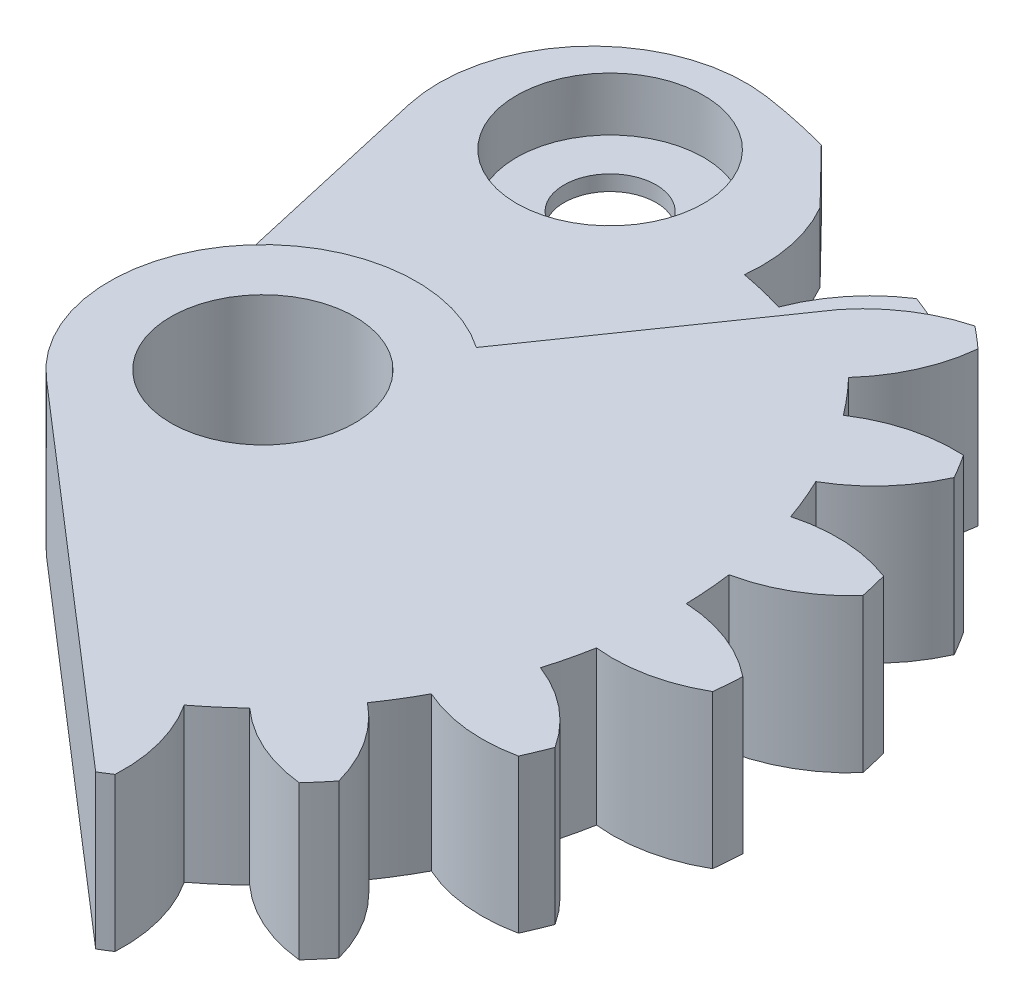
from build123d import *

# Parameters (mm, degrees)
SKETCH_1_R          = 27
EXTRUDE_2_DEPTH     = 10
EXTRUDE_START       = -10
EXTRUDE_3_DEPTH     = 10
CUT_EXTRUDE_2_DEPTH = 48.669538272
SKETCH_6_R          = 6
CUT_EXTRUDE_3_DEPTH = 10
EXTRUDE_5_DEPTH     = 10
SKETCH_10_R         = 6.1
CUT_EXTRUDE_5_DEPTH = 10
CUT_EXTRUDE_START   = -10
CUT_EXTRUDE_6_DEPTH = 10
FILLET_1_R          = 10
CUT_EXTRUDE_START_2 = -5.5
SKETCH_14_R         = 6.1
CUT_EXTRUDE_7_DEPTH = 5.5
EXTRUDE_START_2     = -1
SKETCH_15_R         = 6.1
SKETCH_15_R_2       = 3
EXTRUDE_6_DEPTH     = 1


with BuildPart() as part:
    # 草图1 → 凸台-拉伸2 (new body)
    with BuildSketch(Plane(origin=(0, 0, 0), x_dir=(1, 0, 0), z_dir=(0, 1, 0))):
        with Locations(Location((0, 0, 0), (0, 0, 270))):
            Circle(SKETCH_1_R)
    extrude(amount=EXTRUDE_2_DEPTH)

    # 草图3 → 凸台-拉伸3 (add)
    with BuildSketch(Plane(origin=(0, 10, 0), x_dir=(1, 0, 0), z_dir=(0, 1, 0)).offset(EXTRUDE_START)):
        with BuildLine():
            ThreePointArc((-3.623654542, 26.755730746), (-4.775668185, 29.776890365), (-6.810627033, 32.289554959))
            ThreePointArc((-6.810627033, 32.289554959), (-7.703697007, 32.088207373), (-8.590838072, 31.862164101))
            ThreePointArc((-8.590838072, 31.862164101), (-9.263273827, 28.699511571), (-8.918147734, 25.484635391))
            ThreePointArc((-8.918147734, 25.484635391), (-6.303024824, 26.253987851), (-3.623654542, 26.755730746))
        make_face()
        with BuildLine():
            ThreePointArc((-11.714275763, 24.326441239), (-13.743495509, 26.843742988), (-16.455312443, 28.604592156))
            ThreePointArc((-16.455312443, 28.604592156), (-17.242452636, 28.137125424), (-18.016322714, 27.648003832))
            ThreePointArc((-18.016322714, 27.648003832), (-17.678533741, 24.432348458), (-16.356847947, 21.481469346))
            ThreePointArc((-16.356847947, 21.481469346), (-14.107461247, 23.021284438), (-11.714275763, 24.326441239))
        make_face()
        with BuildLine():
            ThreePointArc((-18.658222053, 19.515910171), (-21.366013737, 21.282943016), (-24.48923722, 22.119612574))
            ThreePointArc((-24.48923722, 22.119612574), (-25.093396865, 21.431785595), (-25.678244161, 20.727464312))
            ThreePointArc((-25.678244161, 20.727464312), (-24.363295599, 17.773576848), (-22.194425918, 15.375547411))
            ThreePointArc((-22.194425918, 15.375547411), (-20.530961071, 17.535097305), (-18.658222053, 19.515910171))
        make_face()
        with BuildLine():
            ThreePointArc((-23.77577157, 12.79502584), (-26.897077674, 13.638820294), (-30.125984831, 13.469411196))
            ThreePointArc((-30.125984831, 13.469411196), (-30.488024573, 12.628553268), (-30.826600159, 11.777976169))
            ThreePointArc((-30.826600159, 11.777976169), (-28.663208335, 9.3750037), (-25.859458842, 7.764559768))
            ThreePointArc((-25.859458842, 7.764559768), (-24.944747378, 10.332452674), (-23.77577157, 12.79502584))
        make_face()
        with BuildLine():
            ThreePointArc((-26.56598291, 4.821675232), (-29.795268245, 4.659634815), (-32.813791147, 3.500730003))
            ThreePointArc((-32.813791147, 3.500730003), (-32.898272013, 2.589150159), (-32.957433752, 1.675577656))
            ThreePointArc((-32.957433752, 1.675577656), (-30.15736653, 0.05873987), (-26.993187762, -0.606477084))
            ThreePointArc((-26.993187762, -0.606477084), (-26.916768011, 2.118395585), (-26.56598291, 4.821675232))
        make_face()
        with BuildLine():
            ThreePointArc((-32.289554959, -6.810627033), (-32.088207373, -7.703697007), (-31.862164101, -8.590838072))
            ThreePointArc((-31.862164101, -8.590838072), (-28.699511571, -9.263273827), (-25.484635391, -8.918147734))
            ThreePointArc((-25.484635391, -8.918147734), (-26.253987851, -6.303024824), (-26.755730746, -3.623654542))
            ThreePointArc((-26.755730746, -3.623654542), (-29.776890365, -4.775668185), (-32.289554959, -6.810627033))
        make_face()
        with BuildLine():
            ThreePointArc((-28.604592156, -16.455312443), (-28.137125424, -17.242452636), (-27.648003832, -18.016322714))
            ThreePointArc((-27.648003832, -18.016322714), (-24.432348458, -17.678533741), (-21.481469346, -16.356847947))
            ThreePointArc((-21.481469346, -16.356847947), (-23.021284438, -14.107461247), (-24.326441239, -11.714275763))
            ThreePointArc((-24.326441239, -11.714275763), (-26.843742988, -13.743495509), (-28.604592156, -16.455312443))
        make_face()
        with BuildLine():
            ThreePointArc((-22.119612574, -24.48923722), (-21.431785595, -25.093396865), (-20.727464312, -25.678244161))
            ThreePointArc((-20.727464312, -25.678244161), (-17.773576848, -24.363295599), (-15.375547411, -22.194425918))
            ThreePointArc((-15.375547411, -22.194425918), (-17.535097305, -20.530961071), (-19.515910171, -18.658222053))
            ThreePointArc((-19.515910171, -18.658222053), (-21.282943016, -21.366013737), (-22.119612574, -24.48923722))
        make_face()
        with BuildLine():
            ThreePointArc((-13.469411196, -30.125984831), (-12.628553268, -30.488024573), (-11.777976169, -30.826600159))
            ThreePointArc((-11.777976169, -30.826600159), (-9.3750037, -28.663208335), (-7.764559768, -25.859458842))
            ThreePointArc((-7.764559768, -25.859458842), (-10.332452674, -24.944747378), (-12.79502584, -23.77577157))
            ThreePointArc((-12.79502584, -23.77577157), (-13.638820294, -26.897077674), (-13.469411196, -30.125984831))
        make_face()
        with BuildLine():
            ThreePointArc((-3.500730003, -32.813791147), (-2.589150159, -32.898272013), (-1.675577656, -32.957433752))
            ThreePointArc((-1.675577656, -32.957433752), (-0.05873987, -30.15736653), (0.606477084, -26.993187762))
            ThreePointArc((0.606477084, -26.993187762), (-2.118395585, -26.916768011), (-4.821675232, -26.56598291))
            ThreePointArc((-4.821675232, -26.56598291), (-4.659634815, -29.795268245), (-3.500730003, -32.813791147))
        make_face()
        with BuildLine():
            ThreePointArc((6.810627033, -32.289554959), (7.703697007, -32.088207373), (8.590838072, -31.862164101))
            ThreePointArc((8.590838072, -31.862164101), (9.263273827, -28.699511571), (8.918147734, -25.484635391))
            ThreePointArc((8.918147734, -25.484635391), (6.303024824, -26.253987851), (3.623654542, -26.755730746))
            ThreePointArc((3.623654542, -26.755730746), (4.775668185, -29.776890365), (6.810627033, -32.289554959))
        make_face()
        with BuildLine():
            ThreePointArc((16.455312443, -28.604592156), (17.242452636, -28.137125424), (18.016322714, -27.648003832))
            ThreePointArc((18.016322714, -27.648003832), (17.678533741, -24.432348458), (16.356847947, -21.481469346))
            ThreePointArc((16.356847947, -21.481469346), (14.107461247, -23.021284438), (11.714275763, -24.326441239))
            ThreePointArc((11.714275763, -24.326441239), (13.743495509, -26.843742988), (16.455312443, -28.604592156))
        make_face()
        with BuildLine():
            ThreePointArc((24.48923722, -22.119612574), (25.093396865, -21.431785595), (25.678244161, -20.727464312))
            ThreePointArc((25.678244161, -20.727464312), (24.363295599, -17.773576848), (22.194425918, -15.375547411))
            ThreePointArc((22.194425918, -15.375547411), (20.530961071, -17.535097305), (18.658222053, -19.515910171))
            ThreePointArc((18.658222053, -19.515910171), (21.366013737, -21.282943016), (24.48923722, -22.119612574))
        make_face()
        with BuildLine():
            ThreePointArc((30.125984831, -13.469411196), (30.488024573, -12.628553268), (30.826600159, -11.777976169))
            ThreePointArc((30.826600159, -11.777976169), (28.663208335, -9.3750037), (25.859458842, -7.764559768))
            ThreePointArc((25.859458842, -7.764559768), (24.944747378, -10.332452674), (23.77577157, -12.79502584))
            ThreePointArc((23.77577157, -12.79502584), (26.897077674, -13.638820294), (30.125984831, -13.469411196))
        make_face()
        with BuildLine():
            ThreePointArc((32.813791147, -3.500730003), (32.898272013, -2.589150159), (32.957433752, -1.675577656))
            ThreePointArc((32.957433752, -1.675577656), (30.15736653, -0.05873987), (26.993187762, 0.606477084))
            ThreePointArc((26.993187762, 0.606477084), (26.998296887, 0.303257671), (27, 0))
            ThreePointArc((27, 0), (26.891276825, -2.420584789), (26.56598291, -4.821675232))
            ThreePointArc((26.56598291, -4.821675232), (29.795268245, -4.659634815), (32.813791147, -3.500730003))
        make_face()
        with BuildLine():
            ThreePointArc((26.755730746, 3.623654542), (29.776890365, 4.775668185), (32.289554959, 6.810627033))
            ThreePointArc((32.289554959, 6.810627033), (32.088207373, 7.703697007), (31.862164101, 8.590838072))
            ThreePointArc((31.862164101, 8.590838072), (28.699511571, 9.263273827), (25.484635391, 8.918147734))
            ThreePointArc((25.484635391, 8.918147734), (26.253987851, 6.303024824), (26.755730746, 3.623654542))
        make_face()
        with BuildLine():
            ThreePointArc((24.326441239, 11.714275763), (26.843742988, 13.743495509), (28.604592156, 16.455312443))
            ThreePointArc((28.604592156, 16.455312443), (28.137125424, 17.242452636), (27.648003832, 18.016322714))
            ThreePointArc((27.648003832, 18.016322714), (24.432348458, 17.678533741), (21.481469346, 16.356847947))
            ThreePointArc((21.481469346, 16.356847947), (23.021284438, 14.107461247), (24.326441239, 11.714275763))
        make_face()
        with BuildLine():
            ThreePointArc((19.515910171, 18.658222053), (21.282943016, 21.366013737), (22.119612574, 24.48923722))
            ThreePointArc((22.119612574, 24.48923722), (21.431785595, 25.093396865), (20.727464312, 25.678244161))
            ThreePointArc((20.727464312, 25.678244161), (17.773576848, 24.363295599), (15.375547411, 22.194425918))
            ThreePointArc((15.375547411, 22.194425918), (17.535097305, 20.530961071), (19.515910171, 18.658222053))
        make_face()
        with BuildLine():
            ThreePointArc((12.79502584, 23.77577157), (13.638820294, 26.897077674), (13.469411196, 30.125984831))
            ThreePointArc((13.469411196, 30.125984831), (12.628553268, 30.488024573), (11.777976169, 30.826600159))
            ThreePointArc((11.777976169, 30.826600159), (9.3750037, 28.663208335), (7.764559768, 25.859458842))
            ThreePointArc((7.764559768, 25.859458842), (10.332452674, 24.944747378), (12.79502584, 23.77577157))
        make_face()
        with BuildLine():
            ThreePointArc((4.821675232, 26.56598291), (4.659634815, 29.795268245), (3.500730003, 32.813791147))
            ThreePointArc((3.500730003, 32.813791147), (2.589150159, 32.898272013), (1.675577656, 32.957433752))
            ThreePointArc((1.675577656, 32.957433752), (0.05873987, 30.15736653), (-0.606477084, 26.993187762))
            ThreePointArc((-0.606477084, 26.993187762), (2.118395585, 26.916768011), (4.821675232, 26.56598291))
        make_face()
    extrude(amount=EXTRUDE_3_DEPTH)

    # 草图4 → 切除-拉伸2 (cut, through all)
    with BuildSketch(Plane(origin=(0, 10, 0), x_dir=(1, 0, 0), z_dir=(0, 1, 0))):
        with BuildLine():
            Line((68.70942434, -72.656830422), (-6.542169106, -7.563069707))
            ThreePointArc((-6.542169106, -7.563069707), (-9.614988938, -2.748088014), (-9.550796477, 2.963492306))
            Line((-9.550796477, 2.963492306), (-2.118395585, 26.916768011))
            Line((-2.118395585, 26.916768011), (19.935579671, 97.992717399))
            ThreePointArc((19.935579671, 97.992717399), (-96.149889375, -27.480880138), (68.70942434, -72.656830422))
        make_face()
    extrude(amount=-CUT_EXTRUDE_2_DEPTH, mode=Mode.SUBTRACT)

    # 草图6 → 切除-拉伸3 (cut)
    with BuildSketch(Plane(origin=(0, 10, 0), x_dir=(1, 0, 0), z_dir=(0, 1, 0))):
        with Locations(Location((0, 0, 0), (0, 0, 270))):
            Circle(SKETCH_6_R)
    extrude(amount=-CUT_EXTRUDE_3_DEPTH, mode=Mode.SUBTRACT)

    # 草图9 → 凸台-拉伸5 (add)
    with BuildSketch(Plane(origin=(0, 10, 0), x_dir=(1, 0, 0), z_dir=(0, 1, 0)).offset(EXTRUDE_START)):
        with BuildLine():
            Line((-18.337271569, 36.810995995), (-10, 0))
            ThreePointArc((-10, 0), (-9.887061363, 1.49867195), (-9.550796477, 2.963492306))
            Line((-9.550796477, 2.963492306), (-2.118395585, 26.916768011))
            ThreePointArc((-2.118395585, 26.916768011), (-1.362972032, 26.965576338), (-0.606477084, 26.993187762))
            ThreePointArc((-0.606477084, 26.993187762), (0.05873987, 30.15736653), (1.675577656, 32.957433752))
            ThreePointArc((1.675577656, 32.957433752), (2.589150159, 32.898272013), (3.500730003, 32.813791147))
            ThreePointArc((3.500730003, 32.813791147), (4.659634815, 29.795268245), (4.821675232, 26.56598291))
            Line((4.821675232, 26.56598291), (7.168022985, 33.612773021))
            ThreePointArc((7.168022985, 33.612773021), (-5.303969741, 37.450057719), (-18.337271569, 36.810995995))
        make_face()
    extrude(amount=EXTRUDE_5_DEPTH)

    # 草图10 → 切除-拉伸5 (cut)
    with BuildSketch(Plane(origin=(0, 10, 0), x_dir=(1, 0, 0), z_dir=(0, 1, 0))):
        with Locations(Location((-6.626815852, 29.258935587, 0), (0, 0, 270))):
            Circle(SKETCH_10_R)
    extrude(amount=-CUT_EXTRUDE_5_DEPTH, mode=Mode.SUBTRACT)

    # 草图11 → 切除-拉伸6 (cut)
    with BuildSketch(Plane(origin=(0, 10, 0), x_dir=(1, 0, 0), z_dir=(0, 1, 0)).offset(CUT_EXTRUDE_START)):
        with BuildLine():
            Line((0, 36.394498532), (3.500730003, 32.813791147))
            ThreePointArc((3.500730003, 32.813791147), (4.659634815, 29.795268245), (4.821675232, 26.56598291))
            Line((4.821675232, 26.56598291), (7.168022985, 33.612773021))
            ThreePointArc((7.168022985, 33.612773021), (3.655030847, 35.186640305), (0, 36.394498532))
        make_face()
    extrude(amount=CUT_EXTRUDE_6_DEPTH, mode=Mode.SUBTRACT)

    # 圆角1
    fillet_1_edges = [part.edges().sort_by_distance(p)[0] for p in [
        (-18.337271569, 5, -36.810995995),
    ]]
    fillet(fillet_1_edges, radius=FILLET_1_R)

    # 草图14 → 切除-拉伸7 (cut)
    with BuildSketch(Plane(origin=(0, 10, 0), x_dir=(1, 0, 0), z_dir=(0, 1, 0)).offset(CUT_EXTRUDE_START_2)):
        with BuildLine():
            Line((5.694647189, 8.220157747), (15.375547411, 22.194425918))
            ThreePointArc((15.375547411, 22.194425918), (14.107461247, 23.021284438), (12.79502584, 23.77577157))
            ThreePointArc((12.79502584, 23.77577157), (13.638820294, 26.897077674), (13.469411196, 30.125984831))
            ThreePointArc((13.469411196, 30.125984831), (12.628553268, 30.488024573), (11.777976169, 30.826600159))
            ThreePointArc((11.777976169, 30.826600159), (9.3750037, 28.663208335), (7.764559768, 25.859458842))
            ThreePointArc((7.764559768, 25.859458842), (6.303024824, 26.253987851), (4.821675232, 26.56598291))
            ThreePointArc((4.821675232, 26.56598291), (4.659634815, 29.795268245), (3.500730003, 32.813791147))
            Line((3.500730003, 32.813791147), (0, 36.394498532))
            ThreePointArc((0, 36.394498532), (-2.23974925, 36.936946702), (-4.508428545, 37.341694744))
            ThreePointArc((-4.508428545, 37.341694744), (-13.300434171, 34.242814336), (-15.716384779, 25.239170332))
            Line((-15.716384779, 25.239170332), (-10, 0))
            ThreePointArc((-10, 0), (-4.639694392, 8.858512062), (5.694647189, 8.220157747))
        make_face()
        with Locations(Location((-6.626815852, 29.258935587, 0), (0, 0, 270))):
            Circle(SKETCH_14_R, mode=Mode.SUBTRACT)
    extrude(amount=CUT_EXTRUDE_7_DEPTH, mode=Mode.SUBTRACT)

    # 草图15 → 凸台-拉伸6 (add)
    with BuildSketch(Plane.XZ.offset(EXTRUDE_START_2)):
        with Locations(Location((-6.626815852, -29.258935587, 0), (0, 0, 90))):
            Circle(SKETCH_15_R)
        with Locations(Location((-6.626815852, -29.258935587, 0), (0, 0, 270))):
            Circle(SKETCH_15_R_2, mode=Mode.SUBTRACT)
    extrude(amount=EXTRUDE_6_DEPTH)


solid = part.part
